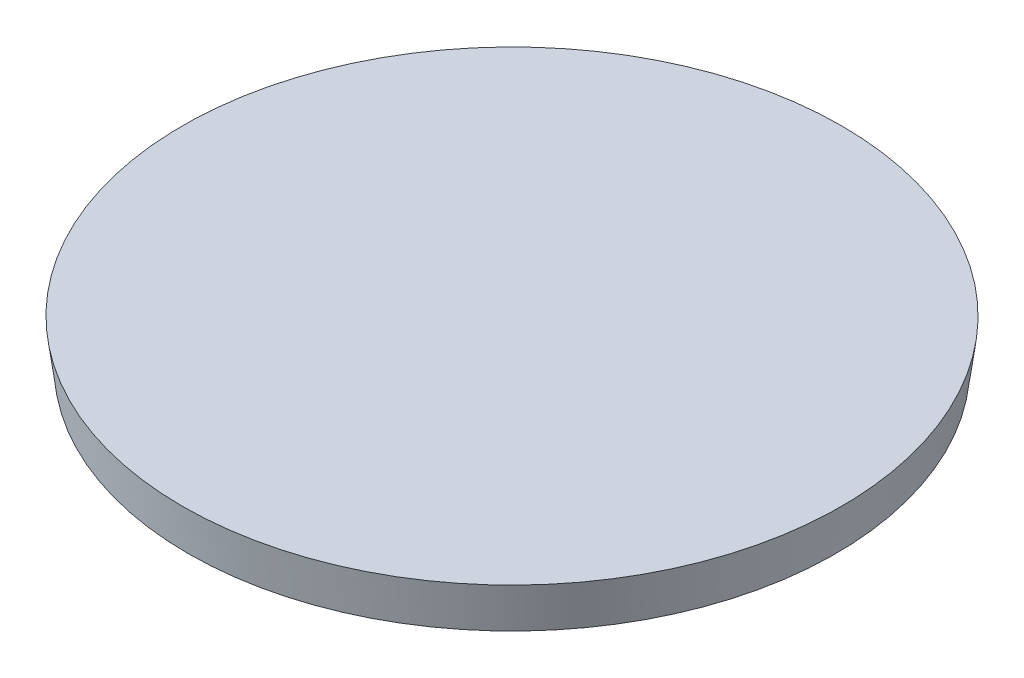
from build123d import *


with BuildPart() as part:
    # Sketch2 → Revolve1 (revolve)
    with BuildSketch(Plane.XY, mode=Mode.PRIVATE) as revolve1_sk:
        Polygon((0, 0), (11.2395, 0), (11.440138406, 1.524), (0, 1.524), align=None)
    revolve(revolve1_sk.sketch.rotate(Axis((0, 1.524, 0), (0, -1, 0)), 90), axis=Axis((0, 1.524, 0), (0, -1, 0)))


solid = part.part
